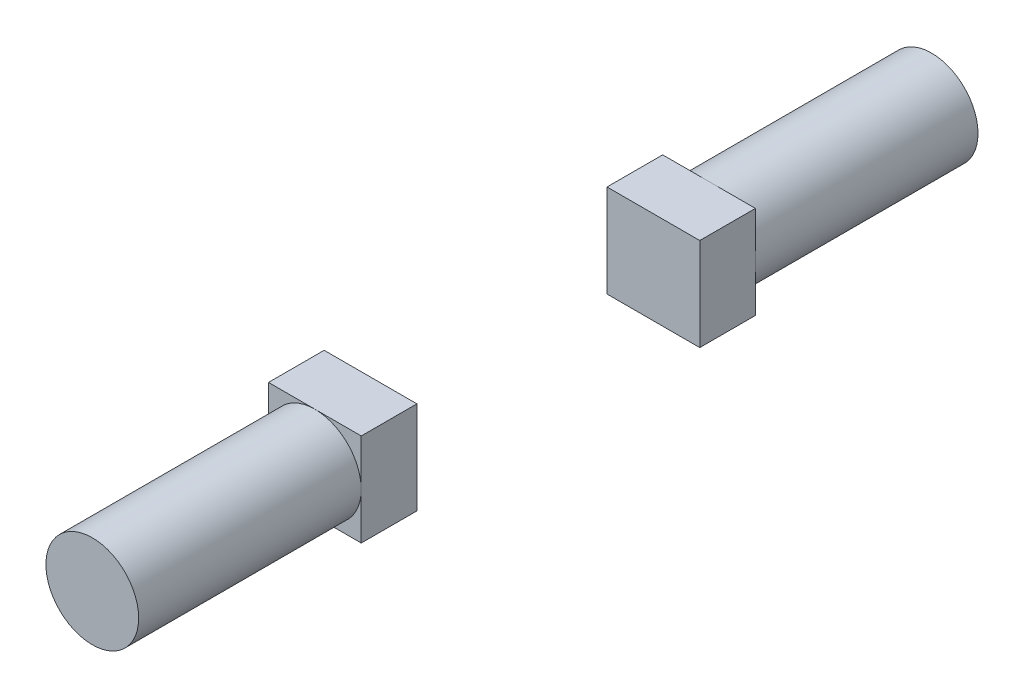
from build123d import *

# Parameters (mm, degrees)
SKETCH1_W           = 10.16
SKETCH1_H           = 10.16
BOSS_EXTRUDE2_DEPTH = 21.59
SKETCH2_R           = 5.08
BOSS_EXTRUDE3_DEPTH = 24.384
SKETCH4_W           = 30.988
SKETCH4_H           = 10.16
CUT_EXTRUDE2_DEPTH  = 48.35652728


with BuildPart() as part:
    # Sketch1 → Boss-Extrude2 (new, symmetric)
    with BuildSketch(Plane.XY):
        Rectangle(SKETCH1_W, SKETCH1_H)
    extrude(amount=BOSS_EXTRUDE2_DEPTH, both=True)

    # Sketch2 → Boss-Extrude3 (add)
    with BuildSketch(Plane.XY.offset(21.59)):
        Circle(SKETCH2_R)
    boss_extrude3 = extrude(amount=BOSS_EXTRUDE3_DEPTH)

    # Mirror1: Boss-Extrude3 across plane
    add(boss_extrude3.mirror(Plane.XY))

    # Sketch4 → Cut-Extrude2 (cut, through all)
    with BuildSketch(Plane(origin=(5.08, 0, 0), x_dir=(0, 0, -1), z_dir=(1, 0, 0))):
        Rectangle(SKETCH4_W, SKETCH4_H)
    extrude(amount=-CUT_EXTRUDE2_DEPTH, mode=Mode.SUBTRACT)


with BuildPart() as cut_extrude2_piece_1:
    # of the separate pieces the step leaves, piece 1, a body of its own (cut_extrude2_pieces)
    add(part.part.solids().sort_by_distance((-5.08, 5.08, 15.494))[0])


with BuildPart() as cut_extrude2_piece_2:
    # of the separate pieces the step leaves, piece 2, a body of its own (cut_extrude2_pieces)
    add(part.part.solids().sort_by_distance((-5.08, 5.08, -21.59))[0])


solid = Compound([cut_extrude2_piece_1.part, cut_extrude2_piece_2.part])
